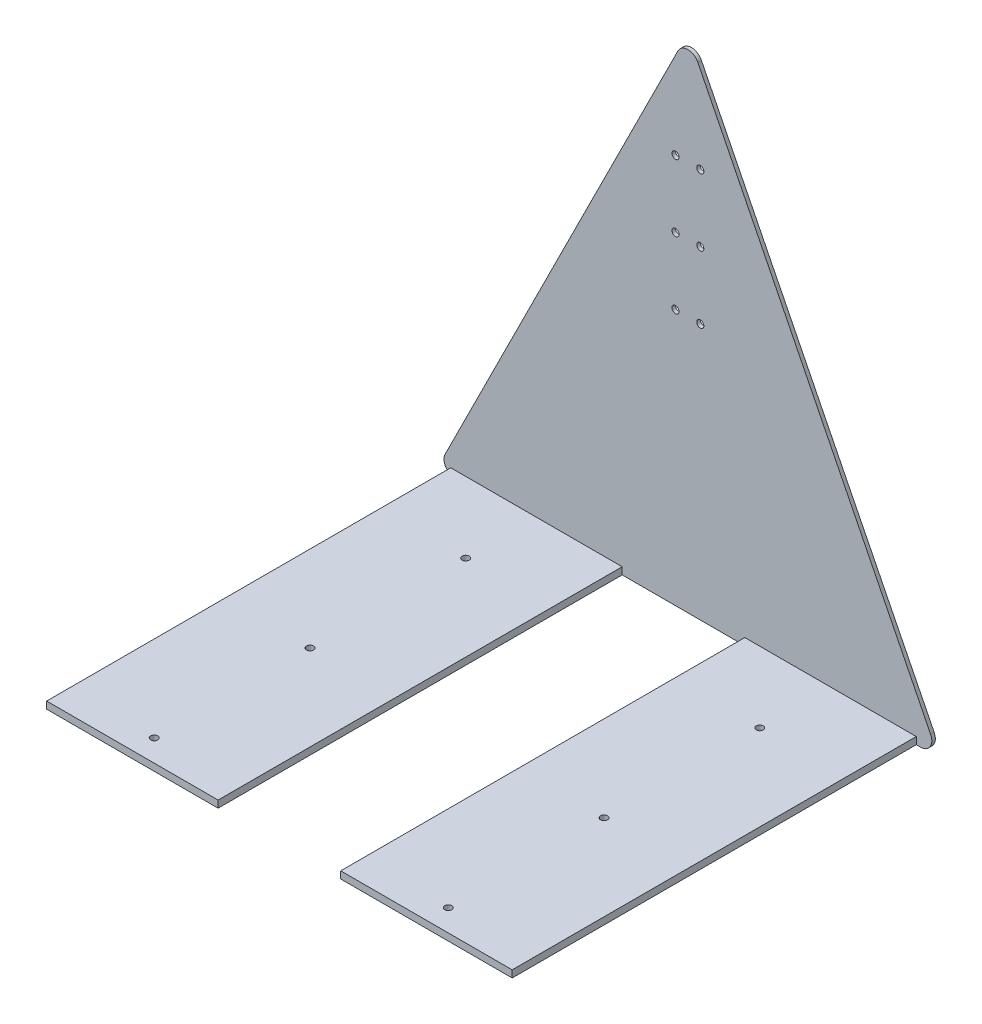
from build123d import *

# Parameters (mm, degrees)
SKETCH1_R           = 161.29
BOSS_EXTRUDE2_DEPTH = 161.29
SKETCH2_W           = 7814.056
SKETCH2_H           = 18415
SKETCH2_R           = 161.29
BOSS_EXTRUDE3_DEPTH = 322.58
SCALE1_SCALE        = 0.039370079


with BuildPart() as part:
    # Sketch1 → Boss-Extrude2 (new body)
    with BuildSketch(Plane.XY):
        with BuildLine():
            Line((-454.375060891, 21951.534316097), (-11061.850005226, 735.172410385))
            ThreePointArc((-11061.850005226, 735.172410385), (-11039.602, 240.922843055), (-10607.474944335, 0))
            Line((-10607.474944335, 0), (10607.474944335, 0))
            ThreePointArc((10607.474944335, 0), (11039.602, 240.922843055), (11061.850005226, 735.172410385))
            Line((11061.850005226, 735.172410385), (454.375060891, 21951.534316097))
            ThreePointArc((454.375060891, 21951.534316097), (0, 22232.361905711), (-454.375060891, 21951.534316097))
        make_face()
        with Locations((-564.515, 11684)):
            Circle(SKETCH1_R, mode=Mode.SUBTRACT)
        with Locations((-564.515, 14732)):
            Circle(SKETCH1_R, mode=Mode.SUBTRACT)
        with Locations((-564.515, 17780)):
            Circle(SKETCH1_R, mode=Mode.SUBTRACT)
        with Locations((564.515, 17780)):
            Circle(SKETCH1_R, mode=Mode.SUBTRACT)
        with Locations((564.515, 14732)):
            Circle(SKETCH1_R, mode=Mode.SUBTRACT)
        with Locations((564.515, 11684)):
            Circle(SKETCH1_R, mode=Mode.SUBTRACT)
    extrude(amount=BOSS_EXTRUDE2_DEPTH)

    # Sketch2 → Boss-Extrude3 (add)
    # profile 1 of 2: a face of its own
    with BuildSketch(Plane(origin=(0, 0, 0), x_dir=(-1, 0, 0), z_dir=(0, -1, 0))):
        with Locations((-6500.040944335, -9368.79)):
            Rectangle(SKETCH2_W, SKETCH2_H)
        with Locations(Location((-6500.040944335, -17580.61, 0), (0, 0, 90))):
            Circle(SKETCH2_R, mode=Mode.SUBTRACT)
        with Locations(Location((-6500.040944335, -10483.85, 0), (0, 0, 90))):
            Circle(SKETCH2_R, mode=Mode.SUBTRACT)
        with Locations(Location((-6500.040944335, -3387.09, 0), (0, 0, 90))):
            Circle(SKETCH2_R, mode=Mode.SUBTRACT)
    # profile 2 of 2: a face of its own
    with BuildSketch(Plane(origin=(0, 0, 0), x_dir=(-1, 0, 0), z_dir=(0, -1, 0))):
        with Locations((6902.015055665, -9368.79)):
            Rectangle(SKETCH2_W, SKETCH2_H)
        with Locations(Location((6902.015055665, -3387.09, 0), (0, 0, 90))):
            Circle(SKETCH2_R, mode=Mode.SUBTRACT)
        with Locations(Location((6902.015055665, -10483.85, 0), (0, 0, 90))):
            Circle(SKETCH2_R, mode=Mode.SUBTRACT)
        with Locations(Location((6902.015055665, -17580.61, 0), (0, 0, 90))):
            Circle(SKETCH2_R, mode=Mode.SUBTRACT)
    extrude(amount=-BOSS_EXTRUDE3_DEPTH)


with BuildPart() as part_1:
    # Scale1: scaled about (-138.333124058, 2480.944734198, 6472.075728879)
    add(part.part.scale(SCALE1_SCALE).moved(Location((-132.886938071, 2383.269744663, 6217.269597821))))


solid = part_1.part
